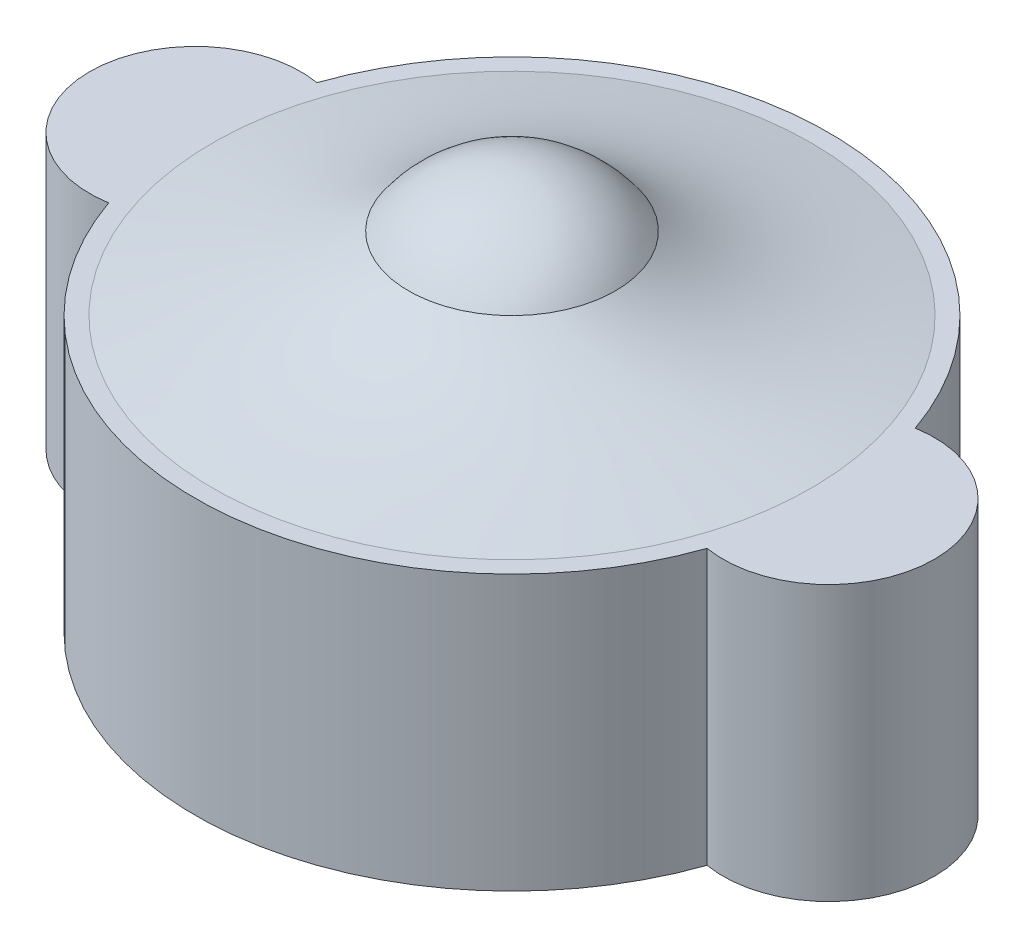
from build123d import *

# Parameters (mm, degrees)
BOSS_EXTRUDE1_DEPTH = 16.51


with BuildPart() as part:
    # Sketch1 → Boss-Extrude1 (new body)
    with BuildSketch(Plane(origin=(0, 0, 0), x_dir=(1, 0, 0), z_dir=(0, 1, 0))):
        with BuildLine():
            ThreePointArc((-17.991666667, -6.261184437), (0, -19.05), (17.991666667, -6.261184437))
            ThreePointArc((17.991666667, -6.261184437), (25.4, 0), (17.991666667, 6.261184437))
            ThreePointArc((17.991666667, 6.261184437), (0, 19.05), (-17.991666667, 6.261184437))
            ThreePointArc((-17.991666667, 6.261184437), (-25.4, 0), (-17.991666667, -6.261184437))
        make_face()
    extrude(amount=BOSS_EXTRUDE1_DEPTH)

    # Sketch2 → Cut-Revolve4 (revolve, cut)
    with BuildSketch(Plane(origin=(0, 16.51, 0), x_dir=(1, 0, 0), z_dir=(0, 1, 0))):
        with BuildLine():
            ThreePointArc((-13.335, 0), (0, -13.335), (13.335, 0))
            Line((13.335, 0), (-13.335, 0))
        make_face()
    revolve(axis=Axis((0, 16.51, 0), (1, 0, 0)), mode=Mode.SUBTRACT)



with BuildPart() as body_2:
    # Sketch2<7> → Revolve1 (revolve)
    with BuildSketch(Plane(origin=(0, 16.51, 0), x_dir=(1, 0, 0), z_dir=(0, 1, 0))):
        with BuildLine():
            Line((7.62, 0), (0, 0))
            Line((0, 0), (-7.62, 0))
            ThreePointArc((-7.62, 0), (0, -7.62), (7.62, 0))
        make_face()
    revolve(axis=Axis((0, 16.51, 0), (1, 0, 0)))


with BuildPart() as part_1:
    add(part.part)

    add(body_2.part)  # Revolve2 merges body 2
    # Sketch3 → Revolve2 (revolve)
    with BuildSketch(Plane.XY):
        with BuildLine():
            Line((-17.991666667, 16.51), (-7.62, 16.51))
            add(Edge.make_bspline(
                [(-6.225616872, 20.903870112), (-7.600669831, 18.930780111), (-7.62, 16.51)],
                knots=[0, 0, 0, 1, 1, 1], degree=2))
            add(Edge.make_bspline(
                [(-17.991666667, 16.51), (-13.949922169, 17.401477486), (-9.562250003, 18.24582827), (-6.225616872, 20.903870112)],
                knots=[0, 0, 0, 0, 1, 1, 1, 1], degree=3))
        make_face()
    revolve(axis=Axis((0, 16.51, 0), (0, 1, 0)))


solid = part_1.part
